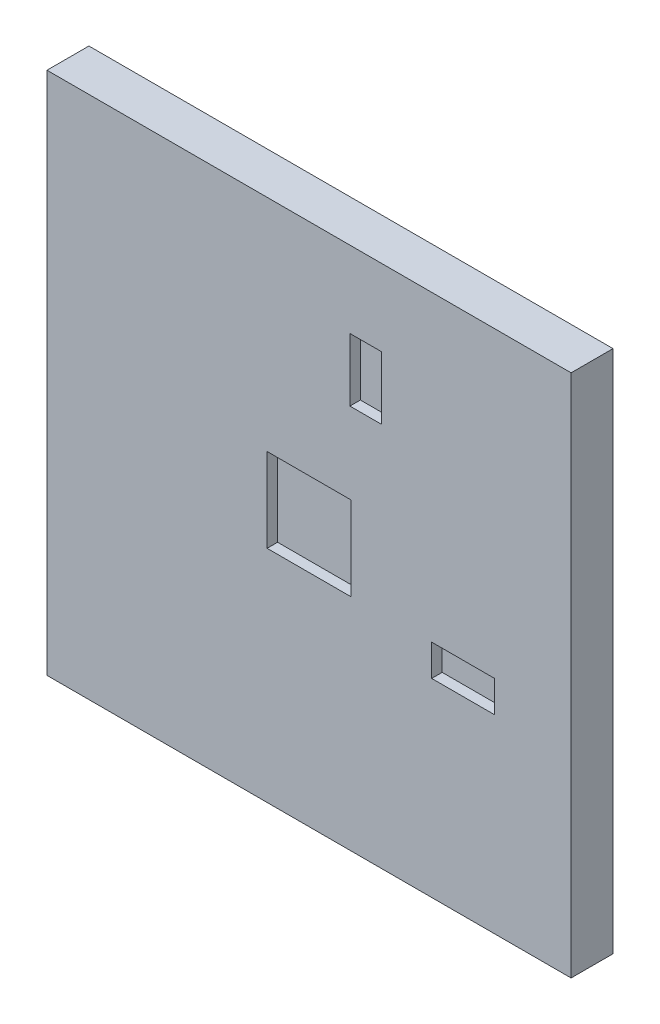
from build123d import *

# Parameters (mm, degrees)
SKETCH1_W           = 250
SKETCH1_H           = 250
BOSS_EXTRUDE1_DEPTH = 20
SKETCH2_W           = 15
SKETCH2_H           = 30
SKETCH2_W_2         = 30
SKETCH2_H_2         = 15
SKETCH2_W_3         = 40
SKETCH2_H_3         = 40
CUT_EXTRUDE1_DEPTH  = 5


with BuildPart() as part:
    # Sketch1 → Boss-Extrude1 (new body)
    with BuildSketch(Plane.XY):
        with Locations((22.048407602, -70.903707865)):
            Rectangle(SKETCH1_W, SKETCH1_H)
    extrude(amount=BOSS_EXTRUDE1_DEPTH)

    # Sketch2 → Cut-Extrude1 (cut)
    with BuildSketch(Plane.XY.offset(20)):
        with Locations((49.048407602, 2.596292135)):
            Rectangle(SKETCH2_W, SKETCH2_H)
        with Locations((95.548407602, -97.903707865)):
            Rectangle(SKETCH2_W_2, SKETCH2_H_2)
        with Locations((22.048407602, -70.903707865)):
            Rectangle(SKETCH2_W_3, SKETCH2_H_3)
    extrude(amount=-CUT_EXTRUDE1_DEPTH, mode=Mode.SUBTRACT)


solid = part.part
